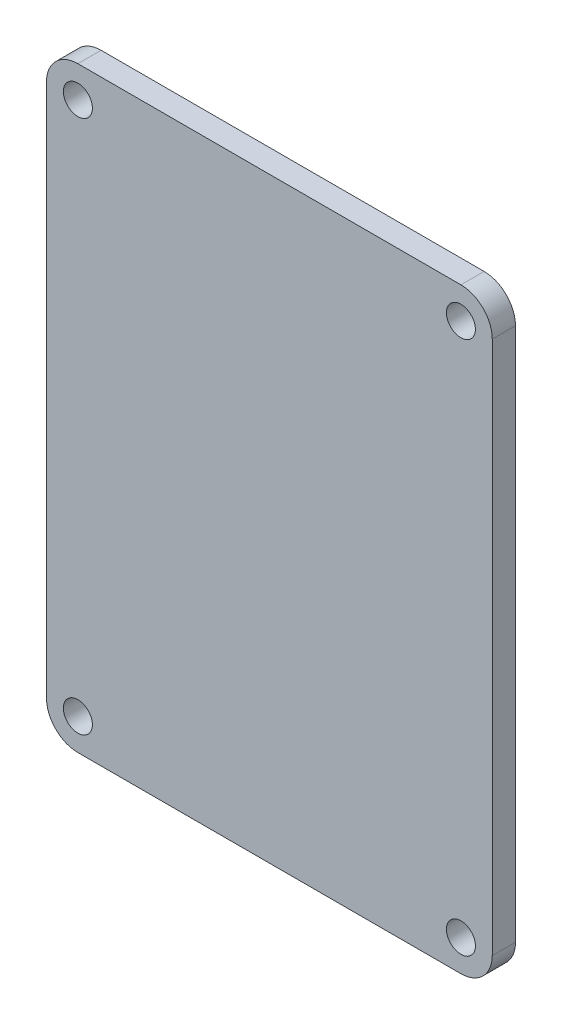
from build123d import *

# Parameters (mm, degrees)
BOSS_EXTRUDE1_DEPTH   = 2
M3_TAPPED_HOLE1_D     = 2.5
M3_TAPPED_HOLE1_DEPTH = 7.5
M3_TAPPED_HOLE1_TIP   = 0.751075774
SKETCH5_R             = 4
CUT_EXTRUDE4_DEPTH    = 0.6


with BuildPart() as part:
    # Sketch1 → Boss-Extrude1 (new body)
    with BuildSketch(Plane.XY.offset(3.579115056)):
        with BuildLine():
            Line((13.461651474, 21.151347876), (-19.538348526, 21.151347876))
            ThreePointArc((-19.538348526, 21.151347876), (-21.447536835, 20.360536186), (-22.238348526, 18.451347876))
            Line((-22.238348526, 18.451347876), (-22.238348526, -27.548652124))
            ThreePointArc((-22.238348526, -27.548652124), (-21.447536835, -29.457840433), (-19.538348526, -30.248652124))
            Line((-19.538348526, -30.248652124), (13.461651474, -30.248652124))
            ThreePointArc((13.461651474, -30.248652124), (15.370839783, -29.457840433), (16.161651474, -27.548652124))
            Line((16.161651474, -27.548652124), (16.161651474, 18.451347876))
            ThreePointArc((16.161651474, 18.451347876), (15.370839783, 20.360536186), (13.461651474, 21.151347876))
        make_face()
    extrude(amount=BOSS_EXTRUDE1_DEPTH)

    # M3 Tapped Hole1
    with Locations(Plane(origin=(0, 0, 3.579115056), x_dir=(-1, 0, 0), z_dir=(0, 0, -1))):
        with Locations((19.538348526, 18.451347876), (-13.461651474, 18.451347876), (-13.461651474, -27.548652124), (19.538348526, -27.548652124)):
            Hole(M3_TAPPED_HOLE1_D / 2, depth=M3_TAPPED_HOLE1_DEPTH)
            with Locations((0, 0, -(M3_TAPPED_HOLE1_DEPTH + M3_TAPPED_HOLE1_TIP / 2))):  # 118° drill point
                Cone(0, M3_TAPPED_HOLE1_D / 2, M3_TAPPED_HOLE1_TIP, mode=Mode.SUBTRACT)

    # Sketch5 → Cut-Extrude4 (cut)
    with BuildSketch(Plane(origin=(0, 0, 3.579115056), x_dir=(-1, 0, 0), z_dir=(0, 0, -1))):
        with Locations((3.038348526, 4.451347876)):
            Circle(SKETCH5_R)
    extrude(amount=-CUT_EXTRUDE4_DEPTH, mode=Mode.SUBTRACT)


solid = part.part
